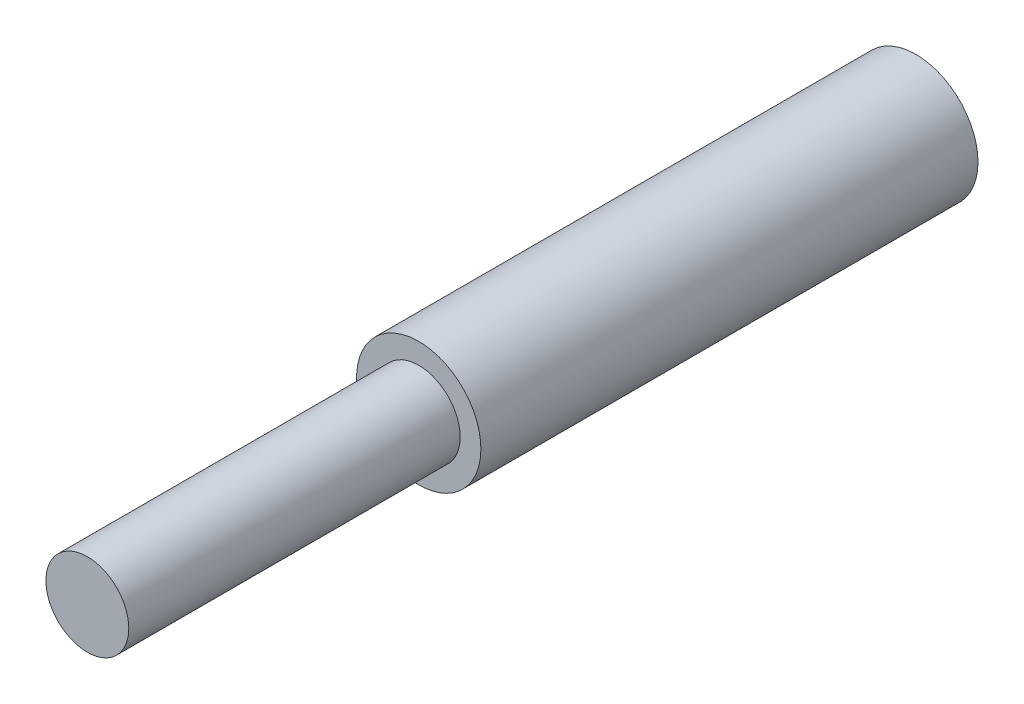
from build123d import *

# Parameters (mm, degrees)
SKETCH_1_R           = 7.5
EXTRUDE_1_DEPTH      = 100
SKETCH_2_OUTSIDE_W   = 37.446
SKETCH_2_OUTSIDE_H   = 37.446
SKETCH_2_OUTSIDE_R   = 5
CUT_EXTRUDE_1_DEPTH  = 40
CUT_EXTRUDE_START    = 5
CUT_EXTRUDE_13_DEPTH = 1.8


with BuildPart() as part:
    # 草图1 → 凸台-拉伸1 (new body)
    with BuildSketch(Plane.XY):
        Circle(SKETCH_1_R)
    extrude(amount=EXTRUDE_1_DEPTH)

    # 草图2 outside → 切除-拉伸1 (cut)
    with BuildSketch(Plane.XY.offset(100)):
        Rectangle(SKETCH_2_OUTSIDE_W, SKETCH_2_OUTSIDE_H)
        Circle(SKETCH_2_OUTSIDE_R, mode=Mode.SUBTRACT)
    extrude(amount=-CUT_EXTRUDE_1_DEPTH, mode=Mode.SUBTRACT)

    # 草图33 → 切除-拉伸13 (cut)
    with BuildSketch(Plane(origin=(-20, 0, 100), x_dir=(0, 0, 1), z_dir=(1.0206823934513925e-11, -1.0, 0)).offset(CUT_EXTRUDE_START)):
        with BuildLine():
            Line((-38.5, -18.5), (-26.5, -18.5))
            ThreePointArc((-26.5, -18.5), (-25, -20), (-26.5, -21.5))
            Line((-26.5, -21.5), (-38.5, -21.5))
            ThreePointArc((-38.5, -21.5), (-40, -20), (-38.5, -18.5))
        make_face()
    extrude(amount=-CUT_EXTRUDE_13_DEPTH, mode=Mode.SUBTRACT)


solid = part.part
